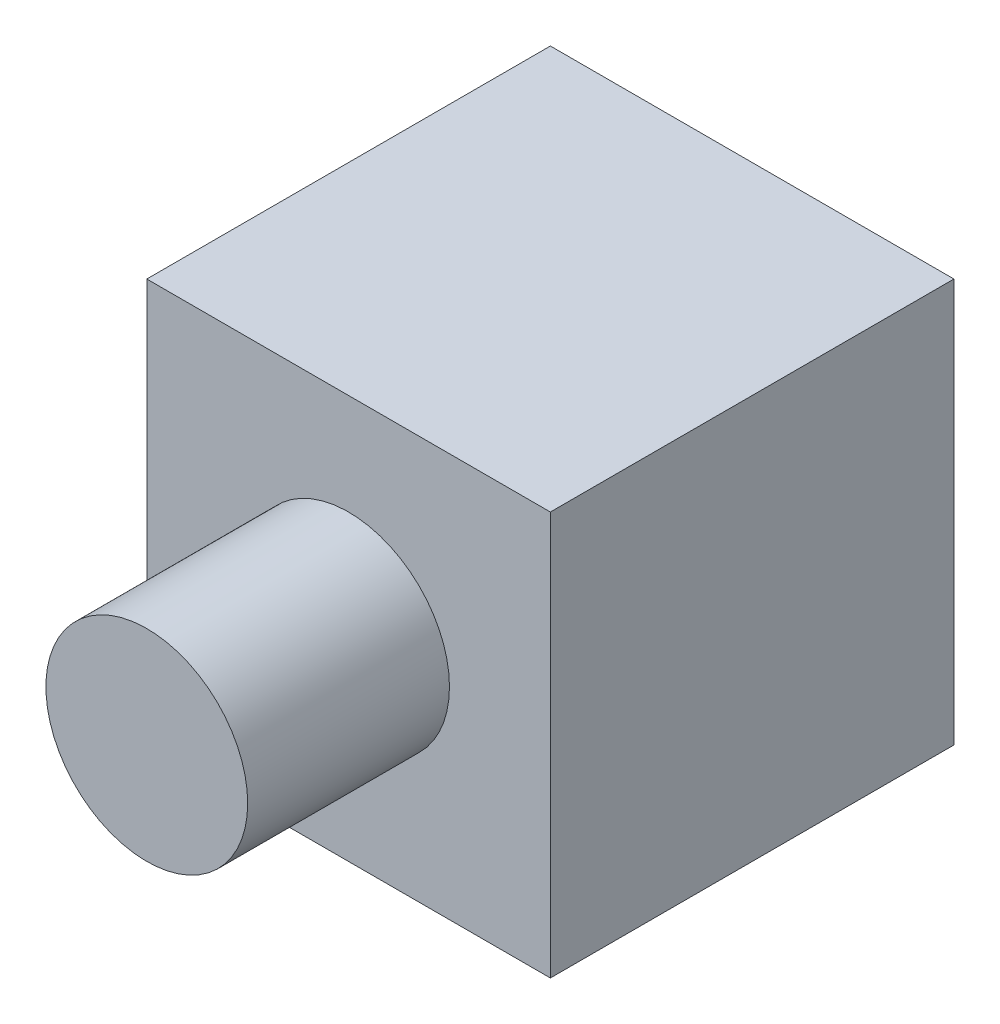
from build123d import *

# Parameters (mm, degrees)
SKETCH1_W           = 50.8
SKETCH1_H           = 50.8
BOSS_EXTRUDE1_DEPTH = 50.8
SKETCH2_R           = 12.7
BOSS_EXTRUDE2_DEPTH = 25.4
SKETCH3_R           = 12.7
CUT_EXTRUDE1_DEPTH  = 25.4


with BuildPart() as part:
    # Sketch1 → Boss-Extrude1 (new body)
    with BuildSketch(Plane.XY):
        Rectangle(SKETCH1_W, SKETCH1_H)
    extrude(amount=-BOSS_EXTRUDE1_DEPTH)

    # Sketch2 → Boss-Extrude2 (add)
    with BuildSketch(Plane.XY):
        Circle(SKETCH2_R)
    extrude(amount=BOSS_EXTRUDE2_DEPTH)

    # Sketch3 → Cut-Extrude1 (cut)
    with BuildSketch(Plane(origin=(0, 0, -50.8), x_dir=(-1, 0, 0), z_dir=(0, 0, -1))):
        with Locations(Location((0, 0, 0), (0, 0, 180))):
            Circle(SKETCH3_R)
    extrude(amount=-CUT_EXTRUDE1_DEPTH, mode=Mode.SUBTRACT)


solid = part.part
